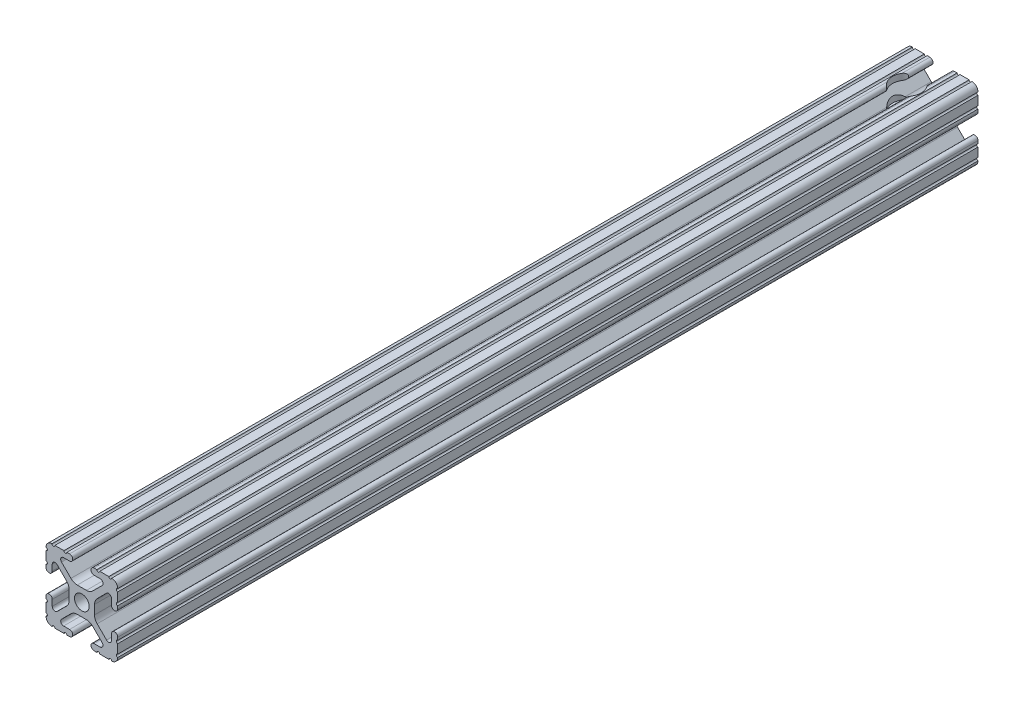
from build123d import *

# Parameters (mm, degrees)
SKETCH1_R           = 2.6035
BOSS_EXTRUDE1_DEPTH = 304.8
CUT_EXTRUDE1_REACH  = 333.419
SKETCH2_R           = 3.81
CUT_EXTRUDE2_REACH  = 333.419
SKETCH3_R           = 5.08


with BuildPart() as part:
    # Sketch1 → Boss-Extrude1 (new body)
    with BuildSketch(Plane(origin=(0, 0, -25.4), x_dir=(-1, 0, 0), z_dir=(0, 0, -1))):
        with BuildLine():
            Line((12.7, -9.5504), (12.7, -6.3330836))
            ThreePointArc((12.7, -6.3330836), (12.192, -5.8250836), (12.7, -5.3170836))
            Line((12.7, -5.3170836), (12.7, -4.3434))
            ThreePointArc((12.7, -4.3434), (11.5951, -3.2385), (10.4902, -4.3434))
            Line((10.4902, -4.3434), (10.4902, -6.474794456))
            ThreePointArc((10.4902, -6.474794456), (9.863006367, -7.413456061), (8.75577951, -7.193214945))
            Line((8.75577951, -7.193214945), (5.42573597, -3.863171405))
            ThreePointArc((5.42573597, -3.863171405), (4.737482484, -2.833127272), (4.4958, -1.618107374))
            Line((4.4958, -1.618107374), (4.4958, 1.618107374))
            ThreePointArc((4.4958, 1.618107374), (4.737482484, 2.833127272), (5.42573597, 3.863171405))
            Line((5.42573597, 3.863171405), (8.75577951, 7.193214945))
            ThreePointArc((8.75577951, 7.193214945), (9.863006367, 7.413456061), (10.4902, 6.474794456))
            Line((10.4902, 6.474794456), (10.4902, 4.343399971))
            ThreePointArc((10.4902, 4.343399971), (11.5951, 3.238499971), (12.7, 4.343399971))
            Line((12.7, 4.343399971), (12.7, 5.3170836))
            ThreePointArc((12.7, 5.3170836), (12.192, 5.8250836), (12.7, 6.3330836))
            Line((12.7, 6.3330836), (12.7, 9.5504))
            ThreePointArc((12.7, 9.5504), (12.192000006, 10.058323491), (12.699846982, 10.566399977))
            ThreePointArc((12.699846982, 10.566399977), (12.082522516, 12.082522516), (10.566399977, 12.699846982))
            ThreePointArc((10.566399977, 12.699846982), (10.058323491, 12.192000006), (9.5504, 12.7))
            Line((9.5504, 12.7), (6.3330836, 12.7))
            ThreePointArc((6.3330836, 12.7), (5.8250836, 12.192), (5.3170836, 12.7))
            Line((5.3170836, 12.7), (4.3434, 12.7))
            ThreePointArc((4.3434, 12.7), (3.2385, 11.5951), (4.3434, 10.4902))
            Line((4.3434, 10.4902), (6.474794456, 10.4902))
            ThreePointArc((6.474794456, 10.4902), (7.413456061, 9.863006367), (7.193214945, 8.75577951))
            Line((7.193214945, 8.75577951), (3.863171405, 5.42573597))
            ThreePointArc((3.863171405, 5.42573597), (2.833127272, 4.737482484), (1.618107374, 4.4958))
            Line((1.618107374, 4.4958), (-1.618107374, 4.4958))
            ThreePointArc((-1.618107374, 4.4958), (-2.833127272, 4.737482484), (-3.863171405, 5.42573597))
            Line((-3.863171405, 5.42573597), (-7.193214945, 8.75577951))
            ThreePointArc((-7.193214945, 8.75577951), (-7.413456061, 9.863006367), (-6.474794456, 10.4902))
            Line((-6.474794456, 10.4902), (-4.343399971, 10.4902))
            ThreePointArc((-4.343399971, 10.4902), (-3.238499971, 11.5951), (-4.343399971, 12.7))
            Line((-4.343399971, 12.7), (-5.3170836, 12.7))
            ThreePointArc((-5.3170836, 12.7), (-5.8250836, 12.192), (-6.3330836, 12.7))
            Line((-6.3330836, 12.7), (-9.5504, 12.7))
            ThreePointArc((-9.5504, 12.7), (-10.058323491, 12.192000006), (-10.566399977, 12.699846982))
            ThreePointArc((-10.566399977, 12.699846982), (-12.082522516, 12.082522516), (-12.699846982, 10.566399977))
            ThreePointArc((-12.699846982, 10.566399977), (-12.192000006, 10.058323491), (-12.7, 9.5504))
            Line((-12.7, 9.5504), (-12.7, 6.3330836))
            ThreePointArc((-12.7, 6.3330836), (-12.192, 5.8250836), (-12.7, 5.3170836))
            Line((-12.7, 5.3170836), (-12.7, 4.3434))
            ThreePointArc((-12.7, 4.3434), (-11.5951, 3.2385), (-10.4902, 4.3434))
            Line((-10.4902, 4.3434), (-10.4902, 6.474794456))
            ThreePointArc((-10.4902, 6.474794456), (-9.863006367, 7.413456061), (-8.75577951, 7.193214945))
            Line((-8.75577951, 7.193214945), (-5.42573597, 3.863171405))
            ThreePointArc((-5.42573597, 3.863171405), (-4.737482484, 2.833127272), (-4.4958, 1.618107374))
            Line((-4.4958, 1.618107374), (-4.4958, -1.618107374))
            ThreePointArc((-4.4958, -1.618107374), (-4.737482484, -2.833127272), (-5.42573597, -3.863171405))
            Line((-5.42573597, -3.863171405), (-8.75577951, -7.193214945))
            ThreePointArc((-8.75577951, -7.193214945), (-9.863006367, -7.413456061), (-10.4902, -6.474794456))
            Line((-10.4902, -6.474794456), (-10.4902, -4.343399971))
            ThreePointArc((-10.4902, -4.343399971), (-11.5951, -3.238499971), (-12.7, -4.343399971))
            Line((-12.7, -4.343399971), (-12.7, -5.3170836))
            ThreePointArc((-12.7, -5.3170836), (-12.192, -5.8250836), (-12.7, -6.3330836))
            Line((-12.7, -6.3330836), (-12.7, -9.5504))
            ThreePointArc((-12.7, -9.5504), (-12.192000006, -10.058323491), (-12.699846982, -10.566399977))
            ThreePointArc((-12.699846982, -10.566399977), (-12.082522516, -12.082522516), (-10.566399977, -12.699846982))
            ThreePointArc((-10.566399977, -12.699846982), (-10.058323491, -12.192000006), (-9.5504, -12.7))
            Line((-9.5504, -12.7), (-6.3330836, -12.7))
            ThreePointArc((-6.3330836, -12.7), (-5.8250836, -12.192), (-5.3170836, -12.7))
            Line((-5.3170836, -12.7), (-4.3434, -12.7))
            ThreePointArc((-4.3434, -12.7), (-3.2385, -11.5951), (-4.3434, -10.4902))
            Line((-4.3434, -10.4902), (-6.474794456, -10.4902))
            ThreePointArc((-6.474794456, -10.4902), (-7.413456061, -9.863006367), (-7.193214945, -8.75577951))
            Line((-7.193214945, -8.75577951), (-3.863171405, -5.42573597))
            ThreePointArc((-3.863171405, -5.42573597), (-2.833127272, -4.737482484), (-1.618107374, -4.4958))
            Line((-1.618107374, -4.4958), (1.618107374, -4.4958))
            ThreePointArc((1.618107374, -4.4958), (2.833127272, -4.737482484), (3.863171405, -5.42573597))
            Line((3.863171405, -5.42573597), (7.193214945, -8.75577951))
            ThreePointArc((7.193214945, -8.75577951), (7.413456061, -9.863006367), (6.474794456, -10.4902))
            Line((6.474794456, -10.4902), (4.343399971, -10.4902))
            ThreePointArc((4.343399971, -10.4902), (3.238499971, -11.5951), (4.343399971, -12.7))
            Line((4.343399971, -12.7), (5.3170836, -12.7))
            ThreePointArc((5.3170836, -12.7), (5.8250836, -12.192), (6.3330836, -12.7))
            Line((6.3330836, -12.7), (9.5504, -12.7))
            ThreePointArc((9.5504, -12.7), (10.058323491, -12.192000006), (10.566399977, -12.699846982))
            ThreePointArc((10.566399977, -12.699846982), (12.082522516, -12.082522516), (12.699846982, -10.566399977))
            ThreePointArc((12.699846982, -10.566399977), (12.192000006, -10.058323491), (12.7, -9.5504))
        make_face()
        with Locations(Location((0, 0, 0), (0, 0, 180))):
            Circle(SKETCH1_R, mode=Mode.SUBTRACT)
    extrude(amount=BOSS_EXTRUDE1_DEPTH)

    # Cut-Extrude1: up to this face of the body (flat: up to its plane)
    cut_extrude1_end = Plane(part.part.faces().sort_by_distance((-7.9417418, -12.7, -177.8))[0])
    # Sketch2 → Cut-Extrude1 (cut, up to the picked face)
    with BuildSketch(Plane(origin=(0, 12.7, 0), x_dir=(1, 0, 0), z_dir=(0, 1, 0)), mode=Mode.PRIVATE) as cut_extrude1_sk1:
        with Locations(Location((0, 317.678514138, 0), (0, 0, 244.868317911))):
            Circle(SKETCH2_R)
    cut_extrude1_tool1 = split(extrude(cut_extrude1_sk1.sketch, amount=-CUT_EXTRUDE1_REACH, mode=Mode.PRIVATE), bisect_by=cut_extrude1_end, keep=Keep.BOTH, mode=Mode.PRIVATE)
    add(cut_extrude1_tool1.solids().sort_by(Axis((0, 12.7, -317.678514), (0, -1, 0)))[0], mode=Mode.SUBTRACT)

    # Cut-Extrude2: up to this face of the body (flat: up to its plane)
    cut_extrude2_end = Plane(part.part.faces().sort_by_distance((0, 4.4958, -325.78468534))[0])
    # Sketch3 → Cut-Extrude2 (cut, up to the picked face)
    with BuildSketch(Plane(origin=(0, 12.7, 0), x_dir=(1, 0, 0), z_dir=(0, 1, 0)), mode=Mode.PRIVATE) as cut_extrude2_sk1:
        with Locations((0, 317.678514138)):
            Circle(SKETCH3_R)
    cut_extrude2_tool1 = split(extrude(cut_extrude2_sk1.sketch, amount=-CUT_EXTRUDE2_REACH, mode=Mode.PRIVATE), bisect_by=cut_extrude2_end, keep=Keep.BOTH, mode=Mode.PRIVATE)
    add(cut_extrude2_tool1.solids().sort_by(Axis((0, 12.7, -317.678514), (0, -1, 0)))[0], mode=Mode.SUBTRACT)


solid = part.part
